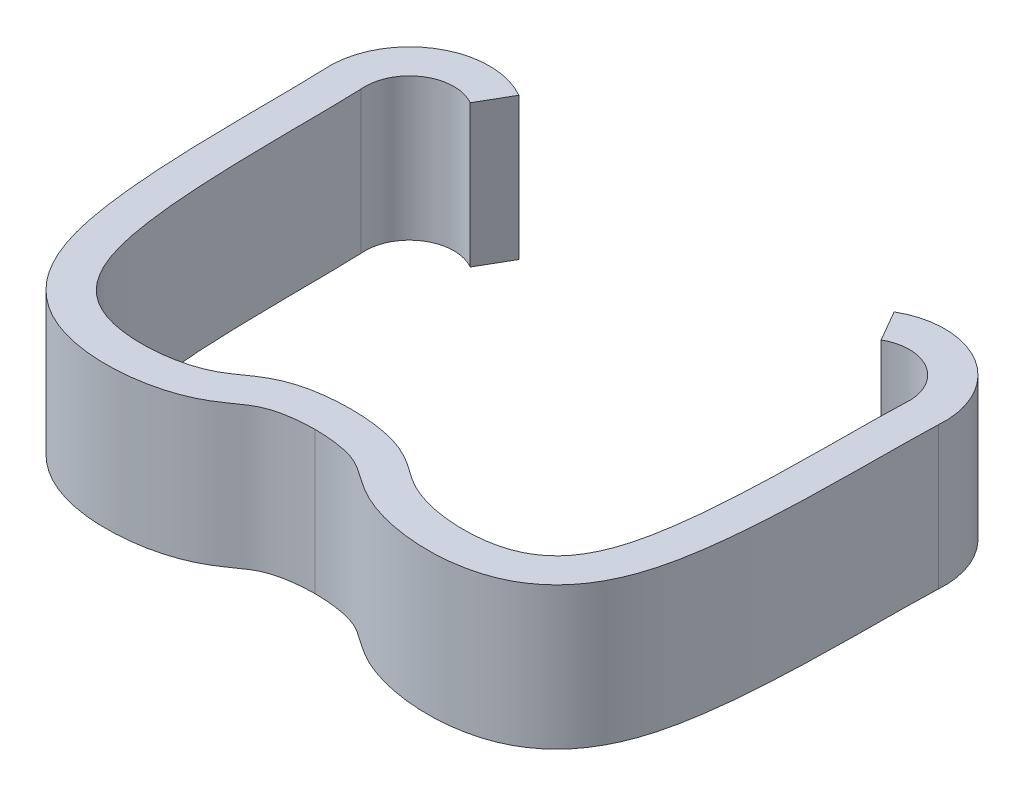
from build123d import *

# Parameters (mm, degrees)
BOSS_EXTRUDE1_DEPTH = 10


with BuildPart() as part:
    # Sketch1 → Boss-Extrude1 (new body)
    with BuildSketch(Plane(origin=(0, 0, 0), x_dir=(1, 0, 0), z_dir=(0, 1, 0))):
        with BuildLine():
            add(Edge.make_bspline(
                [(-21.607690133, -0.440949394), (-21.606040409, -0.481800796), (-21.598654108, -0.672265909), (-21.581483098, -1.200574832), (-21.563441361, -2.084841656), (-21.549999546, -3.263853527), (-21.537221121, -4.959334855), (-21.518911845, -7.264590062), (-21.453813483, -10.184651574), (-21.305035628, -13.126524494), (-21.026923165, -15.966586377), (-20.570401779, -18.606933816), (-19.777682371, -21.089228501), (-18.377046327, -23.377933262), (-16.13518304, -25.147652954), (-13.267850131, -25.997833208), (-10.71727738, -26.06501757), (-8.671438867, -25.790442863), (-7.41767781, -25.463871588), (-6.448426024, -25.095616669), (-5.729884904, -24.751741012), (-5.076145887, -24.354296835), (-4.392640506, -23.876819477), (-3.765530464, -23.431884171), (-3.194003564, -23.134099239), (-2.542504728, -22.916033485), (-1.903996521, -22.772601472), (-1.205957128, -22.682580381), (-0.54480409, -22.63852585), (-0.1558873, -22.627153512), (0.031375944, -22.624803102)],
                knots=[0.011302151, 0.011302151, 0.011302151, 0.011302151, 0.015625, 0.03125, 0.0625, 0.09375, 0.125, 0.1875, 0.25, 0.3125, 0.375, 0.4375, 0.5, 0.5625, 0.625, 0.6875, 0.75, 0.78125, 0.8125, 0.828125, 0.84375, 0.859375, 0.875, 0.90625, 0.9375, 0.953125, 0.96875, 0.984375, 0.9921875, 1, 1, 1, 1], degree=3))
            Line((0.031375944, -22.624803102), (0, -20.125))
            add(Edge.make_bspline(
                [(0, -20.125), (-4.457660769, -20.180949733), (-6.269281831, -23.356141705), (-16.073522623, -24.109359343), (-19.391318728, -16.201423371), (-18.951377965, -4.125321513), (-19.112036002, -0.284353513)],
                knots=[0.129876514, 0.129876514, 0.129876514, 0.129876514, 0.284749452, 0.466339208, 0.741380693, 1.120324662, 1.120324662, 1.120324662, 1.120324662], degree=3))
            ThreePointArc((-19.112036002, -0.284353513), (-17.68413524, 2.632358922), (-14.4375, 2.706329387))
            Line((-14.4375, 2.706329387), (-13.1875, 4.871392896))
            ThreePointArc((-13.1875, 4.871392896), (-19.001419185, 4.757321502), (-21.607690133, -0.440949394))
        make_face()
    boss_extrude1 = extrude(amount=BOSS_EXTRUDE1_DEPTH)

    # Mirror1: Boss-Extrude1 across plane
    add(boss_extrude1.mirror(Plane(origin=(0, 0, 0), x_dir=(0, 0, 1), z_dir=(1, 0, 0))))


solid = part.part
